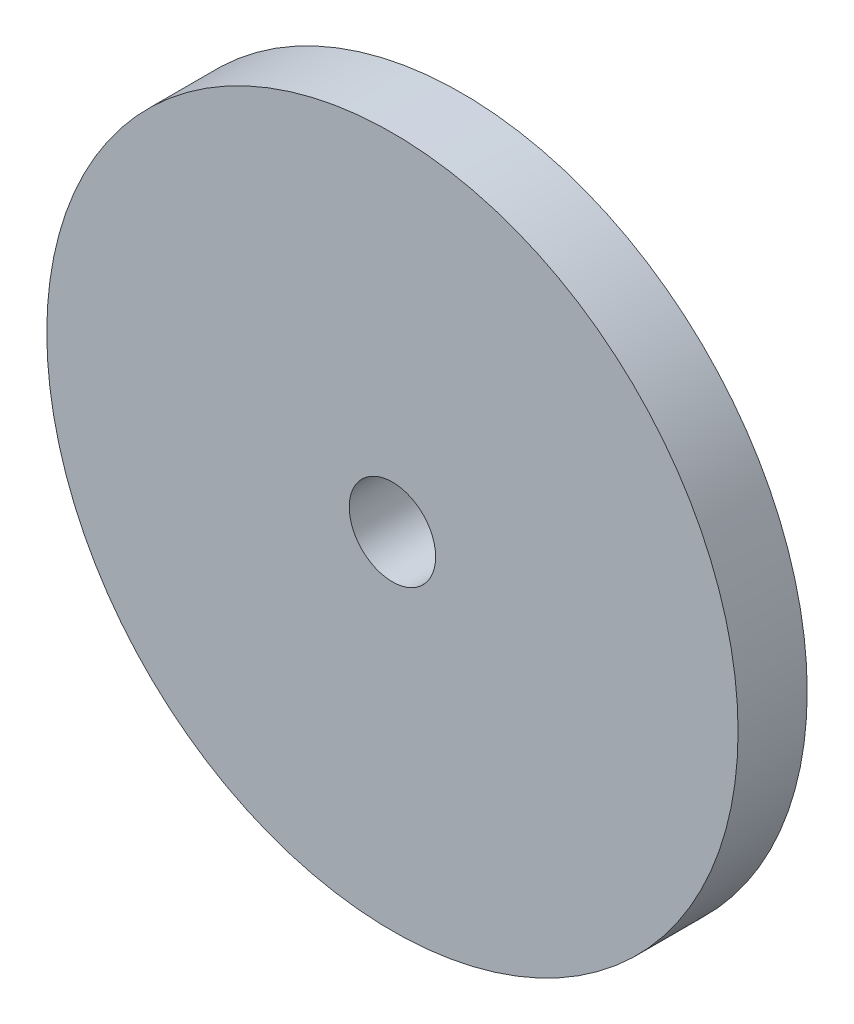
from build123d import *

# Parameters (mm, degrees)
ESQUISSE1_R             = 20
BOSS_EXTRU_1_DEPTH      = 4
ESQUISSE2_R             = 2.5
ENL_V_MAT_EXTRU_1_DEPTH = 29.565713714


with BuildPart() as part:
    # Esquisse1 → Boss.-Extru.1 (new body)
    with BuildSketch(Plane.XY):
        Circle(ESQUISSE1_R)
    extrude(amount=BOSS_EXTRU_1_DEPTH)

    # Esquisse2 → Enlèv. mat.-Extru.1 (cut, through all)
    with BuildSketch(Plane.XY.offset(4)):
        Circle(ESQUISSE2_R)
    extrude(amount=-ENL_V_MAT_EXTRU_1_DEPTH, mode=Mode.SUBTRACT)


solid = part.part
